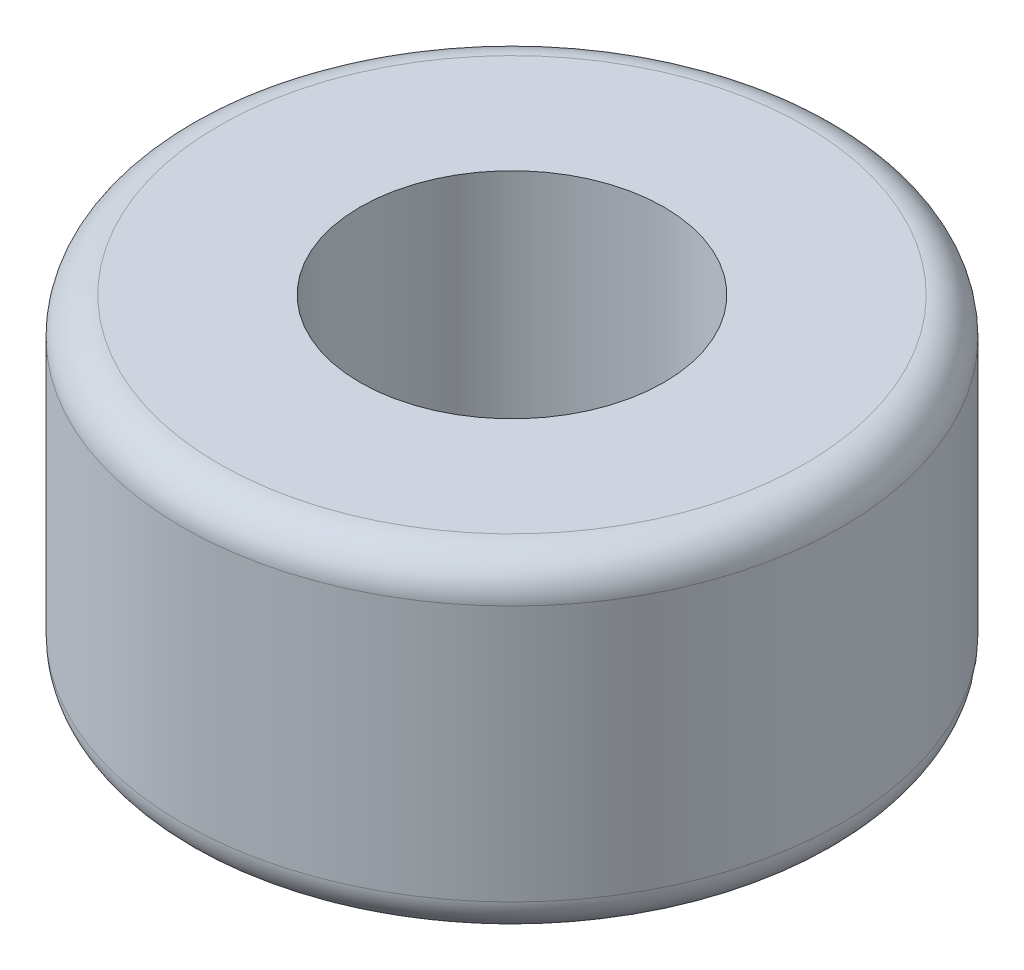
from build123d import *

# Parameters (mm, degrees)
SKETCH_1_R      = 9
SKETCH_1_R_2    = 4.15
EXTRUDE_1_DEPTH = 9
FILLET_1_R      = 1


with BuildPart() as part:
    # 草图1 → 凸台-拉伸1 (new body)
    with BuildSketch(Plane(origin=(0, 0, 0), x_dir=(1, 0, 0), z_dir=(0, 1, 0))):
        with Locations(Location((0, 0, 0), (0, 0, 270))):
            Circle(SKETCH_1_R)
        with Locations(Location((0, 0, 0), (0, 0, 270))):
            Circle(SKETCH_1_R_2, mode=Mode.SUBTRACT)
    extrude(amount=EXTRUDE_1_DEPTH)

    # 圆角1
    fillet_1_edges = [part.edges().sort_by_distance(p)[0] for p in [
        (0, 0, -9),
        (0, 9, -9),
    ]]
    fillet(fillet_1_edges, radius=FILLET_1_R)


solid = part.part
